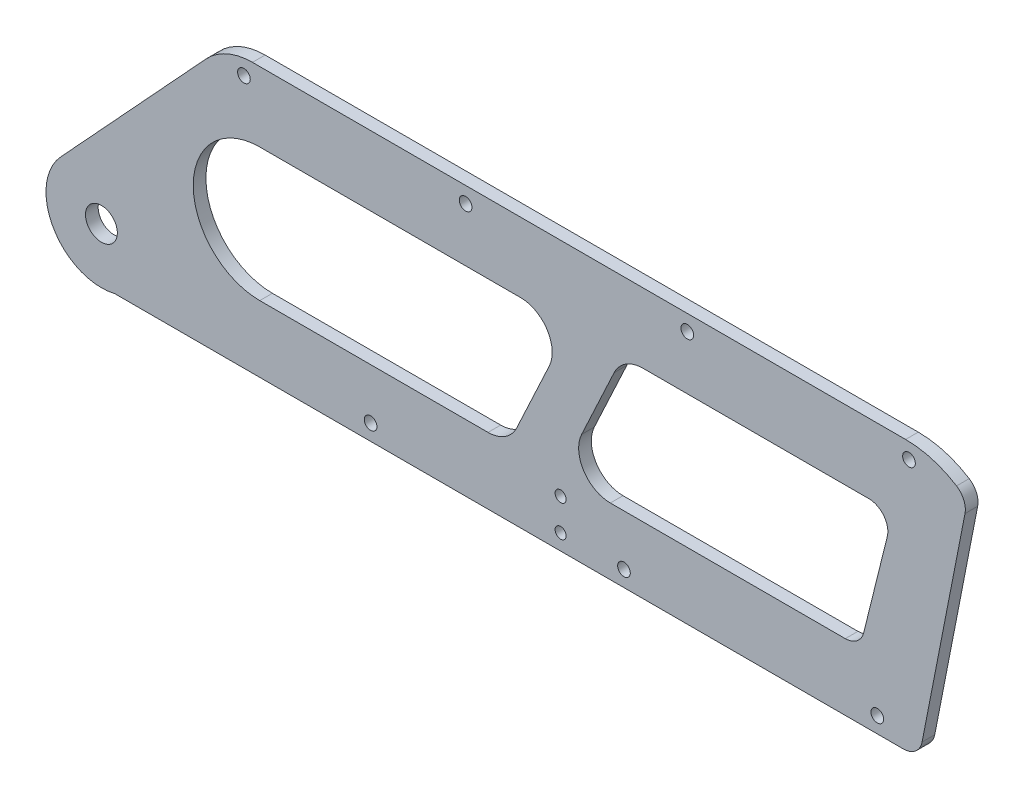
from build123d import *

# Parameters (mm, degrees)
SKETCH_2_R      = 5.03
SKETCH_2_R_2    = 2
SKETCH_2_R_3    = 1.75
EXTRUDE_1_DEPTH = 4


with BuildPart() as part:
    # 草图2 → 凸台-拉伸1 (new body)
    with BuildSketch(Plane.XY):
        with BuildLine():
            Line((-56.063767215, 68), (-262.305181408, 68))
            ThreePointArc((-262.305181408, 68), (-270.328158767, 66.320257484), (-277.003482509, 61.56318343))
            Line((-277.003482509, 61.56318343), (-322.861013463, 11.867785501))
            ThreePointArc((-322.861013463, 11.867785501), (-325.076248752, -8.885759595), (-305.846688069, -17))
            Line((-305.846688069, -17), (-56.75042146, -17))
            ThreePointArc((-56.75042146, -17), (-52.936794137, -15.632088799), (-50.862067991, -12.152082213))
            Line((-50.862067991, -12.152082213), (-37.310871287, 57.108804918))
            ThreePointArc((-37.310871287, 57.108804918), (-37.686816243, 60.630138571), (-39.983089141, 63.326108914))
            ThreePointArc((-39.983089141, 63.326108914), (-47.690693329, 66.807839796), (-56.063767215, 68))
        make_face()
        with Locations((-310, 0)):
            Circle(SKETCH_2_R, mode=Mode.SUBTRACT)
        with Locations((-225, -12)):
            Circle(SKETCH_2_R_2, mode=Mode.SUBTRACT)
        with BuildLine():
            Line((-168.599525043, 31.773817383), (-178.858293522, 9.773817383))
            ThreePointArc((-178.858293522, 9.773817383), (-182.548375309, 5.566085542), (-187.921371393, 4))
            Line((-187.921371393, 4), (-260, 4))
            ThreePointArc((-260, 4), (-281, 25), (-260, 46))
            Line((-260, 46), (-177.662602913, 46))
            ThreePointArc((-177.662602913, 46), (-169.228688455, 41.372996083), (-168.599525043, 31.773817383))
        make_face(mode=Mode.SUBTRACT)
        with Locations((-165, -12)):
            Circle(SKETCH_2_R_3, mode=Mode.SUBTRACT)
        with Locations((-145, -12)):
            Circle(SKETCH_2_R_2, mode=Mode.SUBTRACT)
        with Locations((-165, -2)):
            Circle(SKETCH_2_R_3, mode=Mode.SUBTRACT)
        with Locations((-65, -12)):
            Circle(SKETCH_2_R_2, mode=Mode.SUBTRACT)
        with BuildLine():
            Line((-139.044375749, 46), (-67.670495323, 46))
            ThreePointArc((-67.670495323, 46), (-62.94456946, 43.696704578), (-61.847044732, 38.555208246))
            Line((-61.847044732, 38.555208246), (-69.290012085, 8.555208246))
            ThreePointArc((-69.290012085, 8.555208246), (-71.416758098, 5.274074137), (-75.113462676, 4))
            Line((-75.113462676, 4), (-149.303144229, 4))
            ThreePointArc((-149.303144229, 4), (-157.737058687, 8.627003917), (-158.366222099, 18.226182617))
            Line((-158.366222099, 18.226182617), (-148.10745362, 40.226182617))
            ThreePointArc((-148.10745362, 40.226182617), (-144.417371833, 44.433914458), (-139.044375749, 46))
        make_face(mode=Mode.SUBTRACT)
        with Locations((-265, 63)):
            Circle(SKETCH_2_R_2, mode=Mode.SUBTRACT)
        with Locations((-195, 63)):
            Circle(SKETCH_2_R_2, mode=Mode.SUBTRACT)
        with Locations((-125, 63)):
            Circle(SKETCH_2_R_2, mode=Mode.SUBTRACT)
        with Locations((-55, 63)):
            Circle(SKETCH_2_R_2, mode=Mode.SUBTRACT)
    extrude(amount=EXTRUDE_1_DEPTH)


solid = part.part
